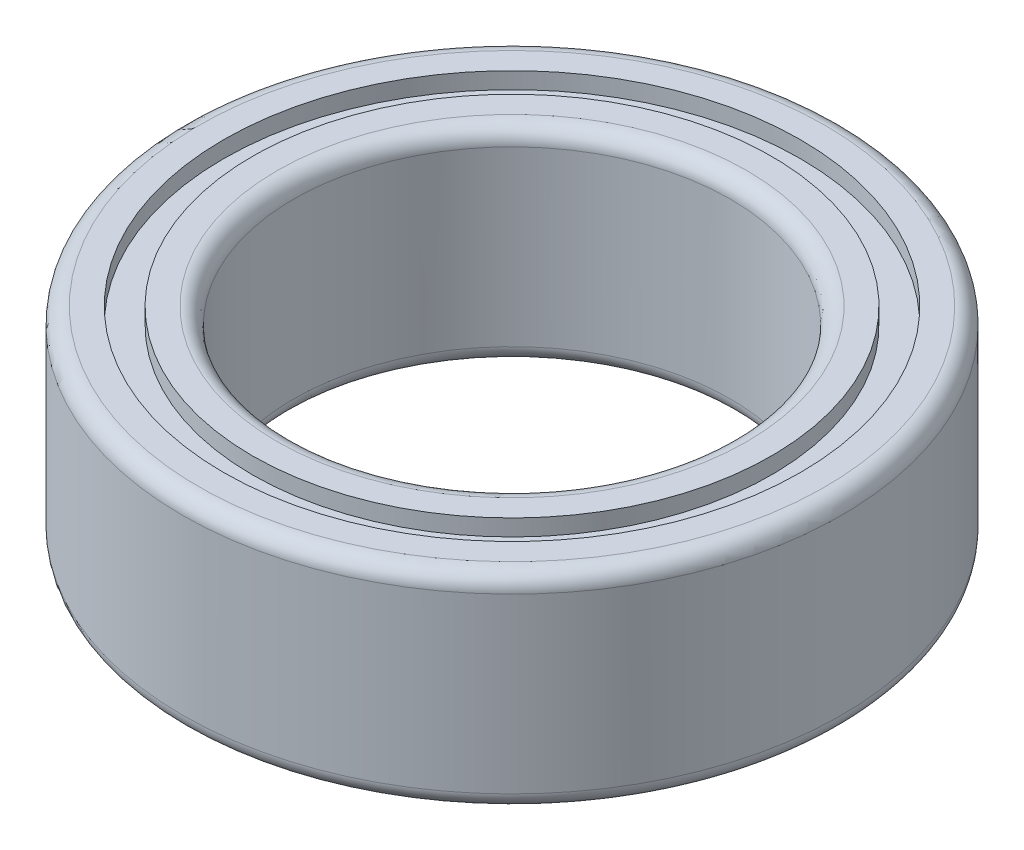
from build123d import *

# Parameters (mm, degrees)
FILLET1_R           = 0.2
SKETCH2_R           = 3.5
SKETCH2_R_2         = 3.15
BOSS_EXTRUDE1_DEPTH = 0.2


with BuildPart() as part:
    # Sketch1 → Revolve1 (revolve)
    with BuildSketch(Plane(origin=(0, 0, 0), x_dir=(0, 0, -1), z_dir=(1, 0, 0)), mode=Mode.PRIVATE) as revolve1_sk:
        Polygon((2.65, 1.25), (2.65, -1.25), (3.15, -1.25), (3.15, -1.05), (3.5, -1.05), (3.5, -1.25), (4, -1.25), (4, 1.25), (3.5, 1.25), (3.5, 1.05), (3.15, 1.05), (3.15, 1.25), align=None)
    revolve(revolve1_sk.sketch.rotate(Axis((0, 1.193675889, 0), (0, -1, 0)), 180), axis=Axis((0, 1.193675889, 0), (0, -1, 0)))

    # Fillet1
    fillet1_edges = [part.edges().sort_by_distance(p)[0] for p in [
        (0, 1.25, -4),
        (0, -1.25, -4),
        (0, -1.25, -2.65),
        (0, 1.25, -2.65),
    ]]
    fillet(fillet1_edges, radius=FILLET1_R)

    # Sketch2 → Boss-Extrude1 (add)
    with BuildSketch(Plane.XZ.offset(1.05)):
        with Locations(Location((0, 0, 0), (0, 0, 90))):
            Circle(SKETCH2_R)
        with Locations(Location((0, 0, 0), (0, 0, 90))):
            Circle(SKETCH2_R_2, mode=Mode.SUBTRACT)
    extrude(amount=BOSS_EXTRUDE1_DEPTH)


solid = part.part
